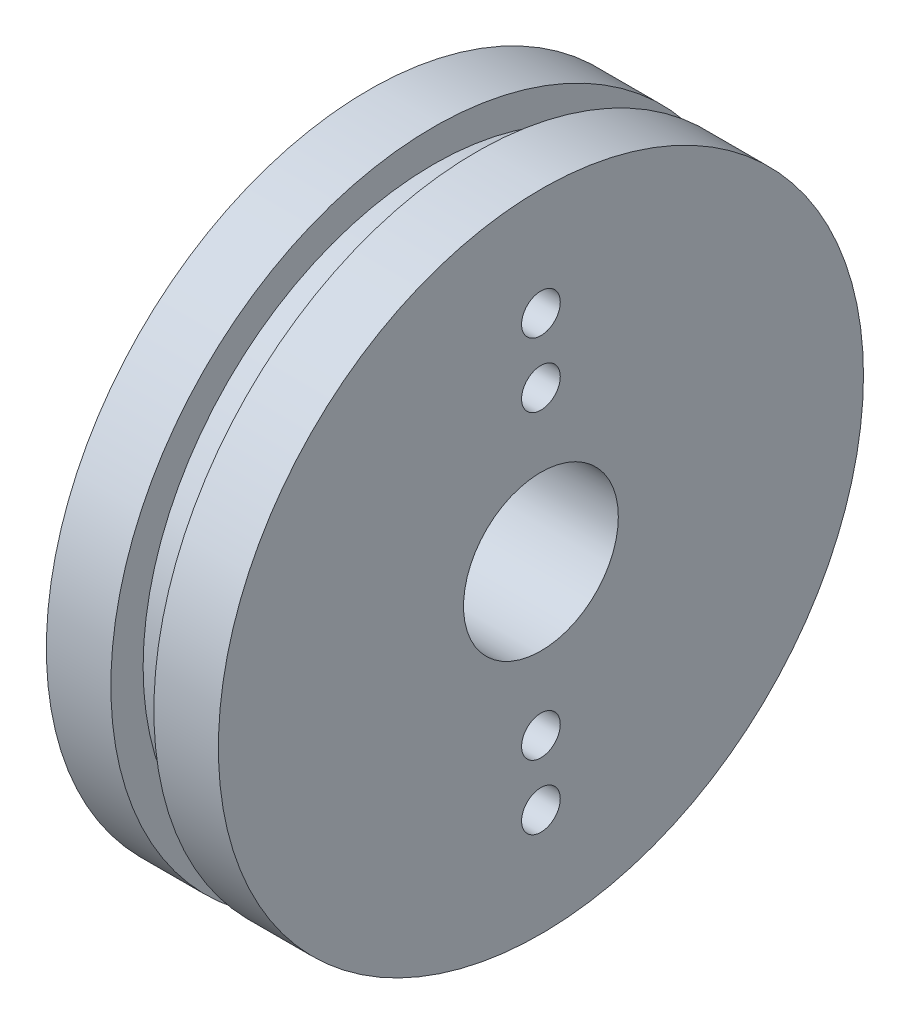
from build123d import *

# Parameters (mm, degrees)
SKETCH1_R           = 15
BOSS_EXTRUDE1_DEPTH = 8
BOSS_EXTRUDE2_START = 3
SKETCH2_R           = 16
BOSS_EXTRUDE2_DEPTH = 2
BOSS_EXTRUDE3_START = 3
SKETCH3_R           = 13.5
BOSS_EXTRUDE3_DEPTH = 2
BOSS_EXTRUDE4_START = -1
SKETCH4_R           = 3.6
BOSS_EXTRUDE4_DEPTH = 10
BOSS_EXTRUDE5_START = -1
SKETCH5_R           = 0.9
BOSS_EXTRUDE5_DEPTH = 10
BOSS_EXTRUDE6_START = -1
SKETCH6_R           = 0.9
BOSS_EXTRUDE6_DEPTH = 10
BOSS_EXTRUDE7_START = -1
SKETCH7_R           = 0.9
BOSS_EXTRUDE7_DEPTH = 10
BOSS_EXTRUDE8_START = -1
SKETCH8_R           = 0.9
BOSS_EXTRUDE8_DEPTH = 10


with BuildPart() as part:
    # Sketch1 → Boss-Extrude1 (new body)
    with BuildSketch(Plane(origin=(0, 0, 0), x_dir=(0, 0, -1), z_dir=(1, 0, 0))):
        Circle(SKETCH1_R)
    extrude(amount=BOSS_EXTRUDE1_DEPTH)


with BuildPart() as body_2:
    # Sketch2 → Boss-Extrude2 (new body)
    with BuildSketch(Plane(origin=(0, 0, 0), x_dir=(0, 0, -1), z_dir=(1, 0, 0)).offset(BOSS_EXTRUDE2_START)):
        Circle(SKETCH2_R)
    extrude(amount=BOSS_EXTRUDE2_DEPTH)


with BuildPart() as part_1:
    add(part.part)

    # Combine1: cut body 2
    add(body_2.part, mode=Mode.SUBTRACT)

    # Sketch3 → Boss-Extrude3 (add)
    with BuildSketch(Plane(origin=(0, 0, 0), x_dir=(0, 0, -1), z_dir=(1, 0, 0)).offset(BOSS_EXTRUDE3_START)):
        Circle(SKETCH3_R)
    extrude(amount=BOSS_EXTRUDE3_DEPTH)


with BuildPart() as body_2_2:
    # Sketch4 → Boss-Extrude4 (new body)
    with BuildSketch(Plane(origin=(0, 0, 0), x_dir=(0, 0, -1), z_dir=(1, 0, 0)).offset(BOSS_EXTRUDE4_START)):
        Circle(SKETCH4_R)
    extrude(amount=BOSS_EXTRUDE4_DEPTH)


with BuildPart() as part_2:
    add(part_1.part)

    # Combine2: cut body 2 2
    add(body_2_2.part, mode=Mode.SUBTRACT)


with BuildPart() as body_2_3:
    # Sketch5 → Boss-Extrude5 (new body)
    with BuildSketch(Plane(origin=(0, 0, 0), x_dir=(0, 0, -1), z_dir=(1, 0, 0)).offset(BOSS_EXTRUDE5_START)):
        with Locations((0, -10)):
            Circle(SKETCH5_R)
    extrude(amount=BOSS_EXTRUDE5_DEPTH)


with BuildPart() as part_3:
    add(part_2.part)

    # Combine3: cut body 2 3
    add(body_2_3.part, mode=Mode.SUBTRACT)


with BuildPart() as body_2_4:
    # Sketch6 → Boss-Extrude6 (new body)
    with BuildSketch(Plane(origin=(0, 0, 0), x_dir=(0, 0, -1), z_dir=(1, 0, 0)).offset(BOSS_EXTRUDE6_START)):
        with Locations((0, -7)):
            Circle(SKETCH6_R)
    extrude(amount=BOSS_EXTRUDE6_DEPTH)


with BuildPart() as part_4:
    add(part_3.part)

    # Combine4: cut body 2 4
    add(body_2_4.part, mode=Mode.SUBTRACT)


with BuildPart() as body_2_5:
    # Sketch7 → Boss-Extrude7 (new body)
    with BuildSketch(Plane(origin=(0, 0, 0), x_dir=(0, 0, -1), z_dir=(1, 0, 0)).offset(BOSS_EXTRUDE7_START)):
        with Locations((0, 7)):
            Circle(SKETCH7_R)
    extrude(amount=BOSS_EXTRUDE7_DEPTH)


with BuildPart() as part_5:
    add(part_4.part)

    # Combine5: cut body 2 5
    add(body_2_5.part, mode=Mode.SUBTRACT)


with BuildPart() as body_2_6:
    # Sketch8 → Boss-Extrude8 (new body)
    with BuildSketch(Plane(origin=(0, 0, 0), x_dir=(0, 0, -1), z_dir=(1, 0, 0)).offset(BOSS_EXTRUDE8_START)):
        with Locations((0, 10)):
            Circle(SKETCH8_R)
    extrude(amount=BOSS_EXTRUDE8_DEPTH)


with BuildPart() as part_6:
    add(part_5.part)

    # Combine6: cut body 2 6
    add(body_2_6.part, mode=Mode.SUBTRACT)


solid = part_6.part
